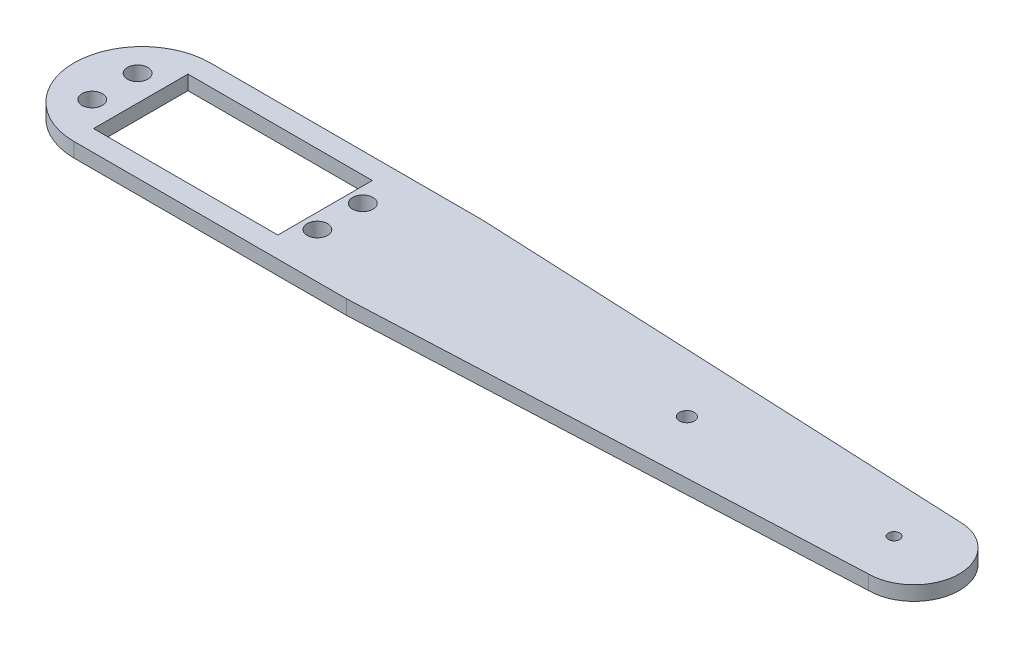
from build123d import *

# Parameters (mm, degrees)
SKETCH1_R           = 2.25
SKETCH1_R_2         = 1.65
SKETCH1_R_3         = 1.25282433
SKETCH1_W           = 40.6
SKETCH1_H           = 20.8
BOSS_EXTRUDE1_DEPTH = 3.175


with BuildPart() as part:
    # Sketch1 → Boss-Extrude1 (new body)
    with BuildSketch(Plane(origin=(0, 0, 0), x_dir=(1, 0, 0), z_dir=(0, 1, 0))):
        with BuildLine():
            Line((-162.38735588, 17.244652891), (-102.38735588, 17.244652891))
            Line((-102.38735588, 17.244652891), (7.61264412, 12.244652891))
            ThreePointArc((7.61264412, 12.244652891), (17.61264412, 2.244652891), (7.61264412, -7.755347109))
            Line((7.61264412, -7.755347109), (-102.38735588, -12.755347109))
            Line((-102.38735588, -12.755347109), (-162.38735588, -12.755347109))
            ThreePointArc((-162.38735588, -12.755347109), (-177.38735588, 2.244652891), (-162.38735588, 17.244652891))
        make_face()
        with Locations(Location((-168.38735588, 7.244652891, 0), (0, 0, 270))):
            Circle(SKETCH1_R, mode=Mode.SUBTRACT)
        with Locations(Location((-168.38735588, -2.755347109, 0), (0, 0, 270))):
            Circle(SKETCH1_R, mode=Mode.SUBTRACT)
        with Locations(Location((-118.78735588, 7.244652891, 0), (0, 0, 270))):
            Circle(SKETCH1_R, mode=Mode.SUBTRACT)
        with Locations(Location((-118.78735588, -2.755347109, 0), (0, 0, 270))):
            Circle(SKETCH1_R, mode=Mode.SUBTRACT)
        with Locations(Location((-42.38735588, 2.244652891, 0), (0, 0, 270))):
            Circle(SKETCH1_R_2, mode=Mode.SUBTRACT)
        with Locations(Location((3.23764412, 2.246310682, 0), (0, 0, 270))):
            Circle(SKETCH1_R_3, mode=Mode.SUBTRACT)
        with Locations((-142.392621679, 2.244652891)):
            Rectangle(SKETCH1_W, SKETCH1_H, mode=Mode.SUBTRACT)
    extrude(amount=BOSS_EXTRUDE1_DEPTH)


solid = part.part
